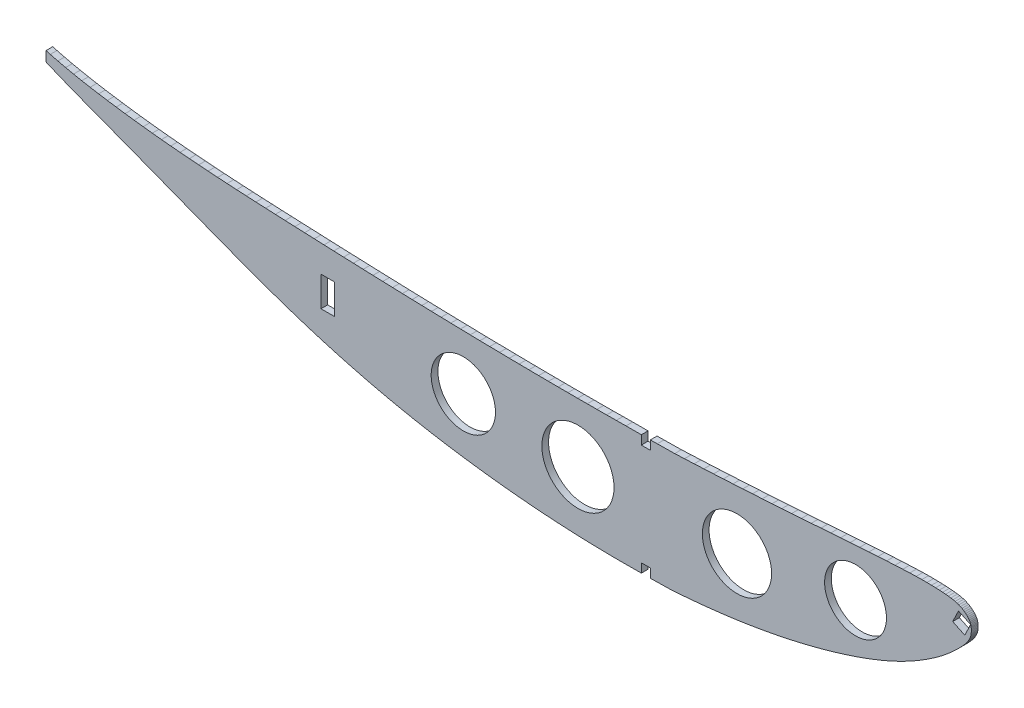
from build123d import *

# Parameters (mm, degrees)
MODEL_R         = 6.917231249
MODEL_R_2       = 7.741442155
MODEL_R_3       = 8.072104191
MODEL_R_4       = 7.188466605
MODEL_W         = 3.015222165
MODEL_H         = 6.7005
EXTRUDE_1_DEPTH = 1.5


with BuildPart() as part:
    # Model → 凸台-拉伸1 (new body)
    with BuildSketch(Plane.XY):
        Polygon((151.298460778, 85.562675149), (152.34807368, 85.117114903), (154.127752671, 84.380977592), (155.967009139, 83.639080275), (157.855000206, 82.896344093), (159.792787098, 82.149623043), (161.772197001, 81.396281057), (163.785159089, 80.635528876), (165.817310526, 79.864454788), (167.860304839, 79.088459555), (169.907302409, 78.306685928), (171.961415244, 77.519579529), (174.016041694, 76.730592326), (176.068685353, 75.9392447), (178.120679413, 75.147315467), (180.165388229, 74.357640992), (182.198502581, 73.570459246), (184.223270463, 72.788678264), (186.244960331, 72.007067261), (188.268564999, 71.226585475), (190.29422045, 70.449695318), (192.311631417, 69.680052733), (194.319155069, 68.921453322), (196.315012588, 68.175230279), (198.295166722, 67.446546396), (200.268817516, 66.734276133), (202.231621756, 66.038041857), (204.182586206, 65.362220781), (206.129781693, 64.707602162), (208.074783059, 64.069159191), (210.014270641, 63.453867475), (211.959053322, 62.856190265), (213.904206279, 62.276399528), (215.850481099, 61.71692368), (217.801503407, 61.17632754), (219.757820812, 60.653345907), (221.715158093, 60.148832354), (223.67669525, 59.66446371), (225.642877906, 59.197127966), (227.612678833, 58.75058673), (229.587740861, 58.321044398), (231.568233971, 57.911578983), (233.555868987, 57.519626088), (235.550679905, 57.145801314), (237.551299537, 56.787710244), (239.555469446, 56.449182476), (241.568594073, 56.127449637), (243.590673419, 55.822511727), (245.617262282, 55.532144306), (247.649112246, 55.258775789), (249.684240522, 55.000045753), (251.722817087, 54.759032212), (253.763440759, 54.532725143), (255.806247519, 54.323586958), (257.851135381, 54.129770847), (259.893897112, 53.953361591), (261.940073138, 53.794053227), (263.986415466, 53.64893772), (266.030699656, 53.522460273), (268.077748541, 53.41250211), (270.121953707, 53.318137989), (272.164750333, 53.242993535), (274.20962806, 53.183171156), (276.248070439, 53.140993602), (278.288216287, 53.118481338), (280.326100022, 53.110913518), (282.359497205, 53.122735343), (284.450709717, 53.129202779), (284.450656549, 55.143785956), (286.450656549, 55.143785956), (286.450656549, 53.143785956), (291.025025682, 53.223412136), (293.038130893, 53.367799882), (295.048227655, 53.532034011), (297.052743724, 53.713119767), (299.048089696, 53.914267076), (301.037346394, 54.135368354), (303.016157629, 54.37534189), (304.986479482, 54.637203958), (306.948268918, 54.919722227), (308.900315125, 55.223555897), (310.843871949, 55.549278099), (312.777090896, 55.896953384), (314.702458142, 56.267111849), (316.614363651, 56.658098651), (318.516655032, 57.074097844), (320.406738523, 57.511498506), (322.28406251, 57.972170648), (324.146097782, 58.454351844), (325.991655042, 58.959317458), (327.811935845, 59.482439405), (329.606517676, 60.02928469), (331.373401423, 60.595604707), (333.105916854, 61.184716968), (334.804572551, 61.79351913), (336.460720683, 62.421696267), (338.073171957, 63.070523742), (339.637527148, 63.737687514), (341.146879338, 64.419727279), (342.59649286, 65.122360657), (343.990508734, 65.840507711), (345.320106995, 66.568924191), (346.580737803, 67.3009829), (347.765365137, 68.029526545), (348.868056206, 68.743657806), (349.882964289, 69.434944025), (350.80736652, 70.09607729), (351.642452196, 70.725782235), (352.394870031, 71.320125185), (353.069506312, 71.877701672), (353.673267957, 72.401972002), (354.214781275, 72.892634937), (354.702056414, 73.349410756), (355.140767961, 73.775802797), (355.53835293, 74.172785186), (355.89982671, 74.542650449), (356.228993875, 74.888350309), (356.526026563, 75.214814087), (356.795388546, 75.526204318), (357.037760542, 75.824347983), (357.255098629, 76.112261354), (357.45050515, 76.390453013), (357.624660822, 76.660749937), (357.775781699, 76.925065173), (357.905143146, 77.184588017), (358.015188307, 77.438616236), (358.101668576, 77.689148943), (358.165200118, 77.936164623), (358.208183044, 78.177728712), (358.225688032, 78.414013345), (358.244114219, 78.727477871), (358.24264288, 78.999963627), (358.239418918, 79.289153879), (358.22924257, 79.526827444), (358.204965421, 79.767362645), (358.141817335, 80.008314495), (358.051450402, 80.247132266), (357.934437752, 80.48256211), (357.791352516, 80.713350181), (357.624637838, 80.938794246), (357.435569082, 81.160083601), (357.223444014, 81.374775102), (356.9888788, 81.582847233), (356.733213356, 81.787337785), (356.453108651, 81.980960362), (356.146780742, 82.16562801), (355.815397408, 82.3394492), (355.454494874, 82.498261396), (355.061371795, 82.635372848), (354.633735644, 82.755798946), (354.169587309, 82.855291086), (353.66282969, 82.935912931), (353.108748635, 83.003998268), (352.500673913, 83.062864609), (351.830194384, 83.118974843), (351.089192316, 83.169527863), (350.26576692, 83.209387008), (349.348275611, 83.240809594), (348.324774566, 83.257426628), (347.181579052, 83.256014492), (345.90685283, 83.233285019), (344.483787309, 83.184889844), (342.907030654, 83.116568108), (341.178495912, 83.030103754), (339.324957902, 82.932581698), (337.374101017, 82.821801348), (335.35558725, 82.69919455), (333.280399986, 82.561293173), (331.160504566, 82.415082376), (329.00699196, 82.260174853), (326.827492837, 82.103090218), (324.636838192, 81.944544392), (322.44252959, 81.787359999), (320.250177068, 81.63319188), (318.059185978, 81.482677717), (315.868940155, 81.335839028), (313.680055764, 81.192654295), (311.493170486, 81.053718167), (309.308900488, 80.919009127), (307.130348111, 80.789035754), (304.950140891, 80.664672418), (302.773759764, 80.543876971), (300.600079983, 80.429773272), (298.424637775, 80.318198784), (296.257399366, 80.211890061), (294.084873674, 80.113168971), (291.909926356, 80.01576628), (288.016549321, 79.964091168), (287.450656549, 79.953076757), (286.450656549, 79.93361298), (286.450656549, 77.93436248), (284.450656549, 77.93436248), (284.450656549, 79.93436248), (281.009020328, 79.93436248), (278.84173508, 79.913262485), (276.67653461, 79.89636972), (274.518411733, 79.884643426), (272.355703992, 79.879345125), (270.19190103, 79.876577226), (268.020401195, 79.879791698), (265.848455737, 79.886118179), (263.669463005, 79.899008636), (261.485749426, 79.915864677), (259.299811408, 79.937165919), (257.11164895, 79.962912364), (254.922493258, 79.993036019), (252.729847924, 80.027057265), (250.540450584, 80.063986546), (248.354369227, 80.105055066), (246.172869056, 80.150810436), (243.994616877, 80.199473841), (241.829530326, 80.251732551), (239.670188174, 80.307378916), (237.514709617, 80.365899318), (235.353928607, 80.429034902), (233.187025566, 80.493126047), (231.004456814, 80.564257111), (228.812688017, 80.636513715), (226.620541589, 80.713113533), (224.423640318, 80.793063332), (222.226807039, 80.874244336), (220.035136553, 80.959462592), (217.842986447, 81.047177255), (215.654563953, 81.135303545), (213.476161081, 81.225963915), (211.304050219, 81.318746738), (209.131871366, 81.410298355), (206.953158854, 81.506533145), (204.769487525, 81.602424299), (202.588448585, 81.701257483), (200.411375229, 81.804811514), (198.240661874, 81.911719202), (196.083182138, 82.023453402), (193.933565576, 82.143398089), (191.794172612, 82.269570472), (189.668866839, 82.404844589), (187.54967942, 82.55027799), (185.445194797, 82.704779128), (183.348161719, 82.871218366), (181.264736215, 83.049255745), (179.186401833, 83.241214015), (177.120991431, 83.443573216), (175.068127375, 83.660676563), (173.027843662, 83.893139659), (170.995215471, 84.14123447), (168.980538067, 84.401305054), (166.985314623, 84.67820824), (165.009409155, 84.969481617), (163.065167714, 85.275060873), (161.155154696, 85.59665683), (159.289321733, 85.935572364), (157.462400366, 86.297038259), (155.681641846, 86.678184154), (153.946120929, 87.084618465), (152.257480448, 87.512545588), (151.298460778, 87.774053168), align=None)
        with Locations((332.353863337, 71.850317245)):
            Circle(MODEL_R, mode=Mode.SUBTRACT)
        with Locations((305.83848333, 67.59930473)):
            Circle(MODEL_R_2, mode=Mode.SUBTRACT)
        with Locations((270.268209518, 66.642349263)):
            Circle(MODEL_R_3, mode=Mode.SUBTRACT)
        with Locations((244.635365459, 67.95825758)):
            Circle(MODEL_R_4, mode=Mode.SUBTRACT)
        Polygon((356.789517129, 77.274798512), (354.08336251, 78.569683516), (355.378247514, 81.275838136), (358.084402134, 79.980953132), align=None, mode=Mode.SUBTRACT)
        with Locations((214.311464381, 71.865428778)):
            Rectangle(MODEL_W, MODEL_H, mode=Mode.SUBTRACT)
    extrude(amount=EXTRUDE_1_DEPTH)


solid = part.part
